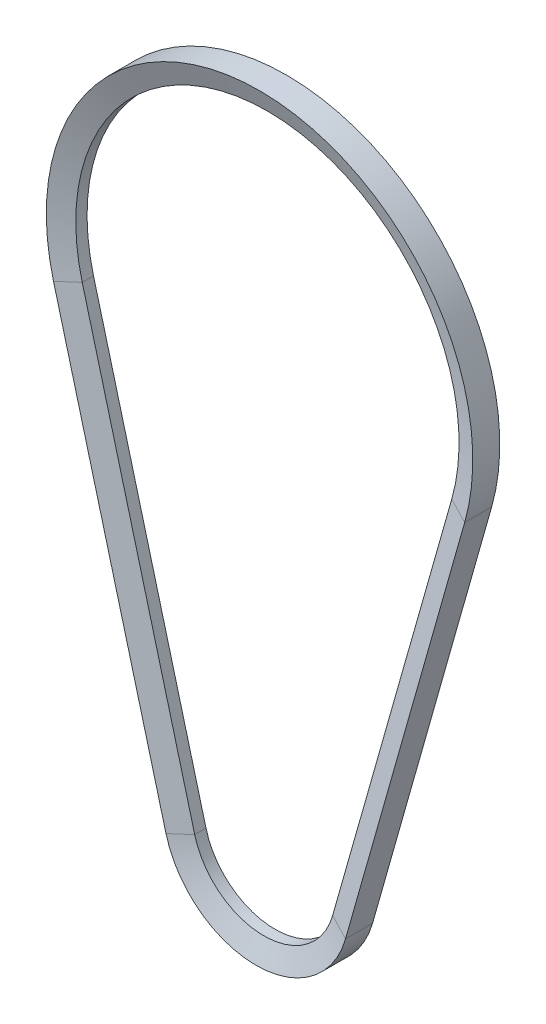
from build123d import *


with BuildPart() as part:
    # Sweep1: sweep along a path in Sketch2
    with BuildLine(Plane.XY) as sweep1_path:
        Line((67.344874662, -19.096278609), (23.203064289, -174.766644959))
        ThreePointArc((23.203064289, -174.766644959), (-1.531764692, -193.309342954), (-25.969645083, -174.377005127))
        Line((-25.969645083, -174.377005127), (-67.639033418, -18.026679068))
        ThreePointArc((-67.639033418, -18.026679068), (0.554655873, 69.997802515), (67.344874662, -19.096278609))
    # Sketch3 → Sweep1 (sweep)
    with BuildSketch(Plane(origin=(-67.639033418, -18.026679068, 0), x_dir=(0.9662719059747307, 0.25752398669631016, 0), z_dir=(-0.25752398669631016, 0.9662719059747307, 0))):
        Polygon((-1, 2.088238126), (-1, -2.088238126), (-9, -5), (-9, 5), align=None)
    sweep(path=sweep1_path.line)


solid = part.part
